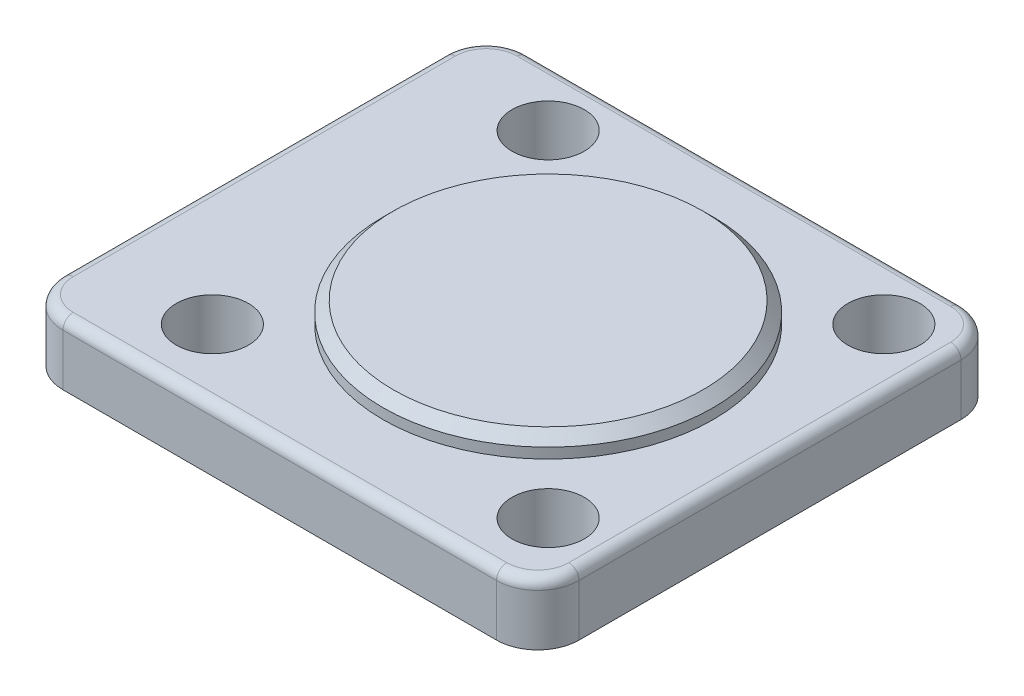
from build123d import *

# Parameters (mm, degrees)
BOSS_EXTRUDE1_DEPTH = 6
SKETCH2_R           = 3.5
CUT_EXTRUDE1_DEPTH  = 37.728735344
SKETCH3_R           = 16
BOSS_EXTRUDE2_DEPTH = 2
CHAMFER1_SIZE       = 1
FILLET1_R           = 1


with BuildPart() as part:
    # Sketch1 → Boss-Extrude1 (new body)
    with BuildSketch(Plane(origin=(0, 0, 0), x_dir=(1, 0, 0), z_dir=(0, 1, 0))):
        with BuildLine():
            Line((-24, 22), (18, 22))
            ThreePointArc((18, 22), (20.828427125, 20.828427125), (22, 18))
            Line((22, 18), (22, -19))
            ThreePointArc((22, -19), (20.828427125, -21.828427125), (18, -23))
            Line((18, -23), (-24, -23))
            ThreePointArc((-24, -23), (-26.828427125, -21.828427125), (-28, -19))
            Line((-28, -19), (-28, 18))
            ThreePointArc((-28, 18), (-26.828427125, 20.828427125), (-24, 22))
        make_face()
    extrude(amount=BOSS_EXTRUDE1_DEPTH)

    # Sketch2 → Cut-Extrude1 (cut, through all)
    with BuildSketch(Plane(origin=(0, 6, 0), x_dir=(1, 0, 0), z_dir=(0, 1, 0))):
        with Locations(Location((16.263455967, 16.263455967, 0), (0, 0, 270))):
            Circle(SKETCH2_R)
        with Locations(Location((16.263455967, -16.263455967, 0), (0, 0, 270))):
            Circle(SKETCH2_R)
        with Locations(Location((-16.263455967, -16.263455967, 0), (0, 0, 270))):
            Circle(SKETCH2_R)
        with Locations(Location((-16.263455967, 16.263455967, 0), (0, 0, 270))):
            Circle(SKETCH2_R)
    extrude(amount=-CUT_EXTRUDE1_DEPTH, mode=Mode.SUBTRACT)

    # Sketch3 → Boss-Extrude2 (add)
    with BuildSketch(Plane(origin=(0, 6, 0), x_dir=(1, 0, 0), z_dir=(0, 1, 0))):
        with Locations(Location((0, 0, 0), (0, 0, 90))):
            Circle(SKETCH3_R)
    extrude(amount=BOSS_EXTRUDE2_DEPTH)

    # Chamfer1
    chamfer1_edges = [part.edges().sort_by_distance(p)[0] for p in [
        (0, 8, 16),
    ]]
    chamfer(chamfer1_edges, length=CHAMFER1_SIZE)

    # Fillet1
    fillet1_edges = [part.edges().sort_by_distance(p)[0] for p in [
        (-26.828427125, 6, -20.828427125),
        (-28, 6, 0.5),
        (-26.828427125, 6, 21.828427125),
        (-3, 6, 23),
        (20.828427125, 6, 21.828427125),
        (22, 6, 0.5),
        (20.828427125, 6, -20.828427125),
        (-3, 6, -22),
    ]]
    fillet(fillet1_edges, radius=FILLET1_R)


solid = part.part
